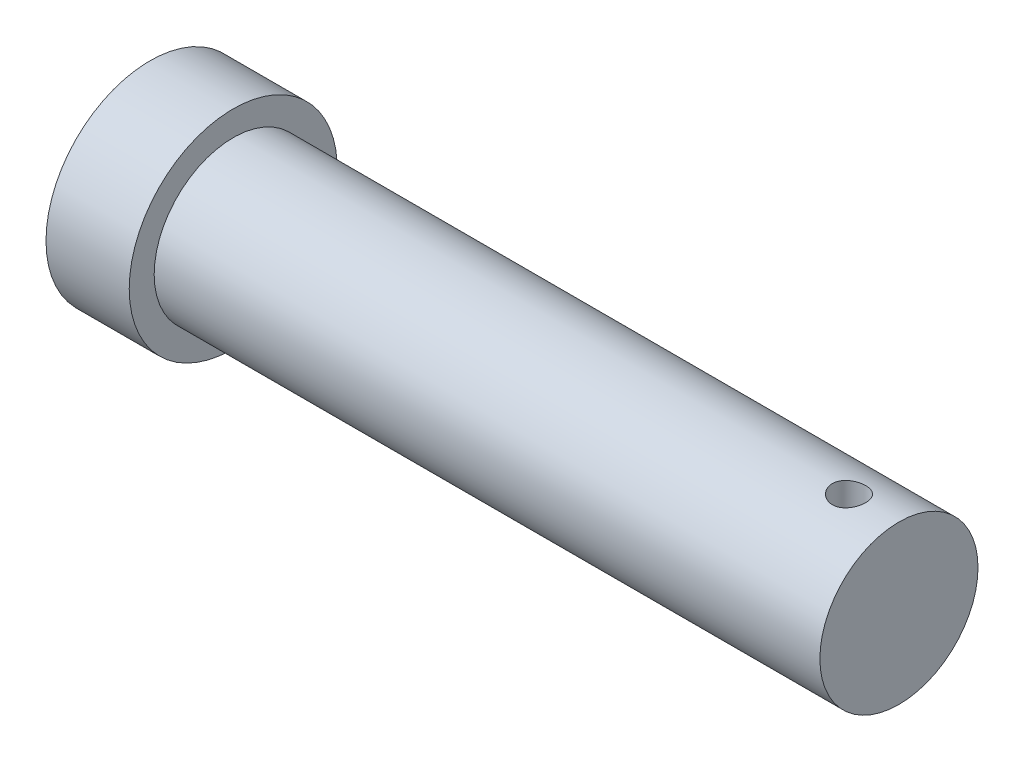
from build123d import *

# Parameters (mm, degrees)
SKETCH1_R               = 1.9
BOSS_EXTRUDE1_DEPTH     = 18
CUT_EXTRUDE1_DEPTH      = 10
CUT_EXTRUDE1_DEPTH_BACK = 10
SKETCH2_R               = 0.4
SKETCH3_R               = 2.5
BOSS_EXTRUDE2_DEPTH     = 2
SCALE1_SCALE            = 1.5


with BuildPart() as part:
    # Sketch1 → Boss-Extrude1 (new body)
    with BuildSketch(Plane(origin=(0, 0, 0), x_dir=(0, 0, -1), z_dir=(1, 0, 0))):
        Circle(SKETCH1_R)
    extrude(amount=BOSS_EXTRUDE1_DEPTH)

    # Sketch2 → Cut-Extrude1 (cut, two sides: drawn at the far end of the back side and taken through both)
    with BuildSketch(Plane(origin=(0, 0, 0), x_dir=(1, 0, 0), z_dir=(0, 1, 0)).offset(-CUT_EXTRUDE1_DEPTH_BACK)):
        with Locations((16.8, 0)):
            Circle(SKETCH2_R)
    extrude(amount=CUT_EXTRUDE1_DEPTH + CUT_EXTRUDE1_DEPTH_BACK, mode=Mode.SUBTRACT)

    # Sketch3 → Boss-Extrude2 (add)
    with BuildSketch(Plane.ZY):
        Circle(SKETCH3_R)
    extrude(amount=-BOSS_EXTRUDE2_DEPTH)


with BuildPart() as part_1:
    # Scale1: scaled about (0, 0, 0)
    add(part.part.scale(SCALE1_SCALE))


solid = part_1.part
